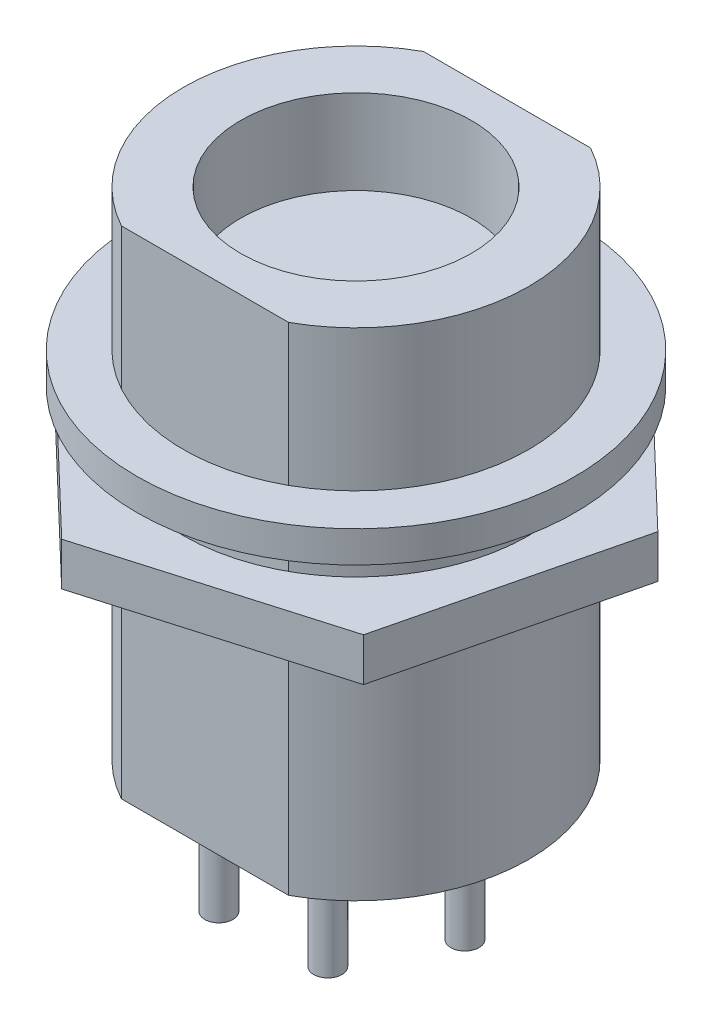
from build123d import *

# Parameters (mm, degrees)
SKETCH2_W           = 44.390968634
SKETCH2_H           = 30.096733946
SKETCH2_W_2         = 26.63458118
SKETCH2_H_2         = 14
CUT_EXTRUDE1_DEPTH  = 26.632011236
SKETCH3_R           = 0.653357701
BOSS_EXTRUDE1_DEPTH = 5
CIRPATTERN1_COUNT   = 6
SKETCH5_W           = 2.152737125
SKETCH5_H           = 1.455877733
BOSS_EXTRUDE2_START = -10
SKETCH6_R           = 8
BOSS_EXTRUDE2_DEPTH = 2


with BuildPart() as part:
    # Sketch1 → Revolve1 (revolve)
    with BuildSketch(Plane.XY, mode=Mode.PRIVATE) as revolve1_sk:
        Polygon((-8, 0), (-5.345132743, 0), (-5.345132743, -3.924247536), (0, -3.924247536), (0, -23), (-8, -23), align=None)
    revolve(revolve1_sk.sketch.rotate(Axis((0, 0, 0), (0, -1, 0)), 270), axis=Axis((0, 0, 0), (0, -1, 0)))

    # Sketch2 → Cut-Extrude1 (cut, through all)
    with BuildSketch(Plane(origin=(0, 0, 0), x_dir=(1, 0, 0), z_dir=(0, 1, 0))):
        Rectangle(SKETCH2_W, SKETCH2_H)
        Rectangle(SKETCH2_W_2, SKETCH2_H_2, mode=Mode.SUBTRACT)
    extrude(amount=-CUT_EXTRUDE1_DEPTH, mode=Mode.SUBTRACT)

    # Sketch3 → Boss-Extrude1 (add)
    with BuildSketch(Plane.XZ.offset(23)):
        with Locations(Location((2.639463, 3.944197551, 0), (0, 0, 270))):
            Circle(SKETCH3_R)
    boss_extrude1 = extrude(amount=BOSS_EXTRUDE1_DEPTH)

    # CirPattern1: Boss-Extrude1 ×6 about axis
    cirpattern1_axis = Axis((0, 0, 0), (0, 1, 0))
    for i in range(1, CIRPATTERN1_COUNT):
        add(boss_extrude1.rotate(cirpattern1_axis, i * 360 / CIRPATTERN1_COUNT))


with BuildPart() as body_2:
    # Sketch5 → Revolve2 (revolve)
    with BuildSketch(Plane.XY, mode=Mode.PRIVATE) as revolve2_sk:
        with Locations((-9.076368563, -7.272061134)):
            Rectangle(SKETCH5_W, SKETCH5_H)
    revolve(revolve2_sk.sketch.rotate(Axis((0, 0, 0), (0, 1, 0)), 270), axis=Axis((0, 0, 0), (0, 1, 0)))


with BuildPart() as body_3:
    # Sketch6 → Boss-Extrude2 (new body)
    with BuildSketch(Plane(origin=(0, 0, 0), x_dir=(1, 0, 0), z_dir=(0, 1, 0)).offset(BOSS_EXTRUDE2_START)):
        Polygon((10.832217083, 3.158309077), (2.680932648, 10.960129712), (-8.151284436, 7.801820635), (-10.832217083, -3.158309077), (-2.680932648, -10.960129712), (8.151284436, -7.801820635), align=None)
        with Locations(Location((0, 0, 0), (0, 0, 270))):
            Circle(SKETCH6_R, mode=Mode.SUBTRACT)
    extrude(amount=-BOSS_EXTRUDE2_DEPTH)


solid = Compound([part.part, body_2.part, body_3.part])
